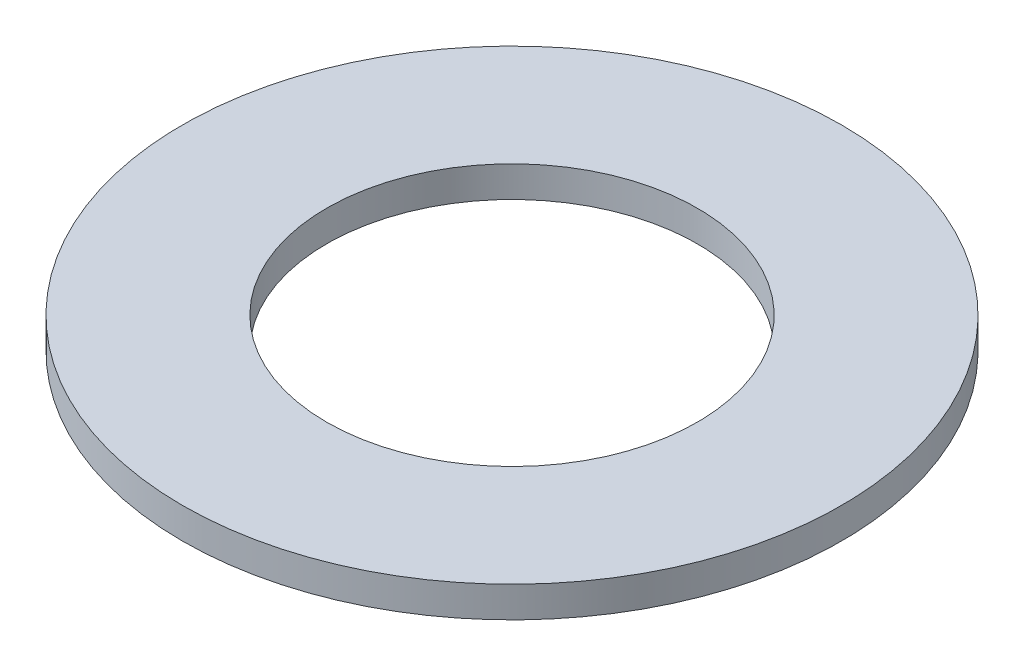
from build123d import *

# Parameters (mm, degrees)
SKETCH1_R           = 16
SKETCH1_R_2         = 9
BOSS_EXTRUDE1_DEPTH = 1.5


with BuildPart() as part:
    # Sketch1 → Boss-Extrude1 (new body)
    with BuildSketch(Plane(origin=(0, 0, 0), x_dir=(1, 0, 0), z_dir=(0, 1, 0))):
        with Locations(Location((0, 0, 0), (0, 0, 270))):
            Circle(SKETCH1_R)
        with Locations(Location((0, 0, 0), (0, 0, 270))):
            Circle(SKETCH1_R_2, mode=Mode.SUBTRACT)
    extrude(amount=BOSS_EXTRUDE1_DEPTH)


solid = part.part
